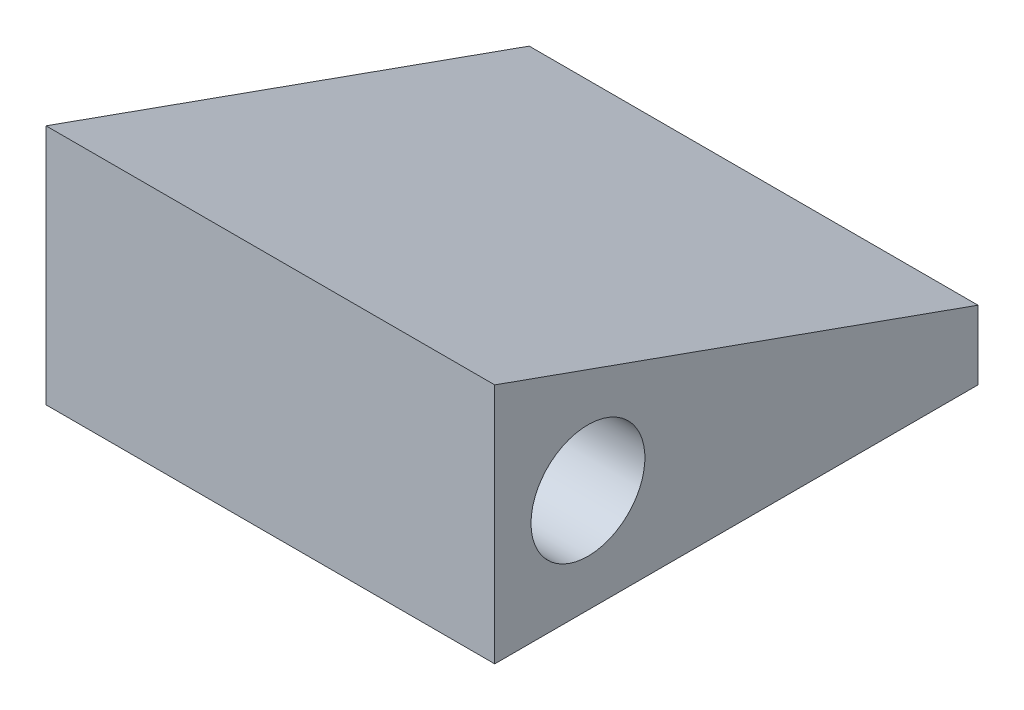
from build123d import *

# Parameters (mm, degrees)
SKETCH1_W           = 13
SKETCH1_H           = 14
BOSS_EXTRUDE1_DEPTH = 2
BOSS_EXTRUDE2_DEPTH = 13
SKETCH3_R           = 1.65
CUT_EXTRUDE1_DEPTH  = 13


with BuildPart() as part:
    # Sketch1 → Boss-Extrude1 (new body)
    with BuildSketch(Plane(origin=(0, 0, 0), x_dir=(1, 0, 0), z_dir=(0, 1, 0))):
        Rectangle(SKETCH1_W, SKETCH1_H)
    extrude(amount=BOSS_EXTRUDE1_DEPTH)

    # Sketch2 → Boss-Extrude2 (add)
    with BuildSketch(Plane(origin=(6.5, 0, 0), x_dir=(0, 0, -1), z_dir=(1, 0, 0))):
        Polygon((-7, 2), (-7, 7), (7, 2), align=None)
    extrude(amount=-BOSS_EXTRUDE2_DEPTH)

    # Sketch3 → Cut-Extrude1 (cut)
    with BuildSketch(Plane.ZY.offset(6.5)):
        with Locations((4.3, 3)):
            Circle(SKETCH3_R)
    extrude(amount=-CUT_EXTRUDE1_DEPTH, mode=Mode.SUBTRACT)


solid = part.part
